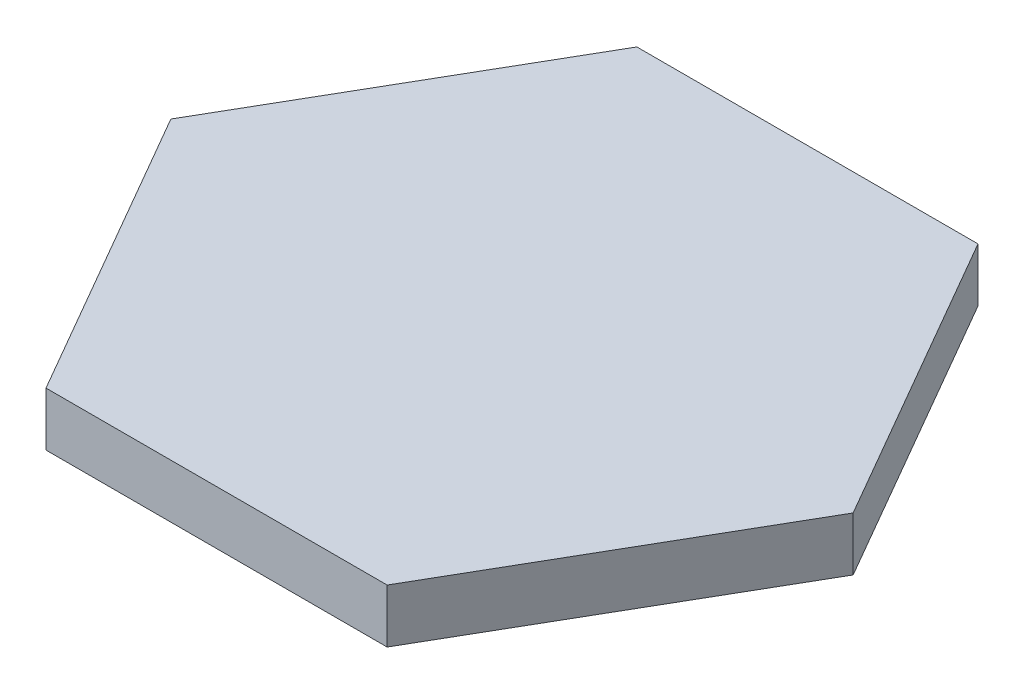
from build123d import *

# Parameters (mm, degrees)
BOSS_EXTRUDE1_DEPTH = 12.7


with BuildPart() as part:
    # Sketch1 → Boss-Extrude1 (new body)
    with BuildSketch(Plane(origin=(0, 0, 0), x_dir=(1, 0, 0), z_dir=(0, 1, 0))):
        Polygon((40.327916303, -69.85), (80.655832606, 0), (40.327916303, 69.85), (-40.327916303, 69.85), (-80.655832606, 0), (-40.327916303, -69.85), align=None)
    extrude(amount=BOSS_EXTRUDE1_DEPTH)


solid = part.part
